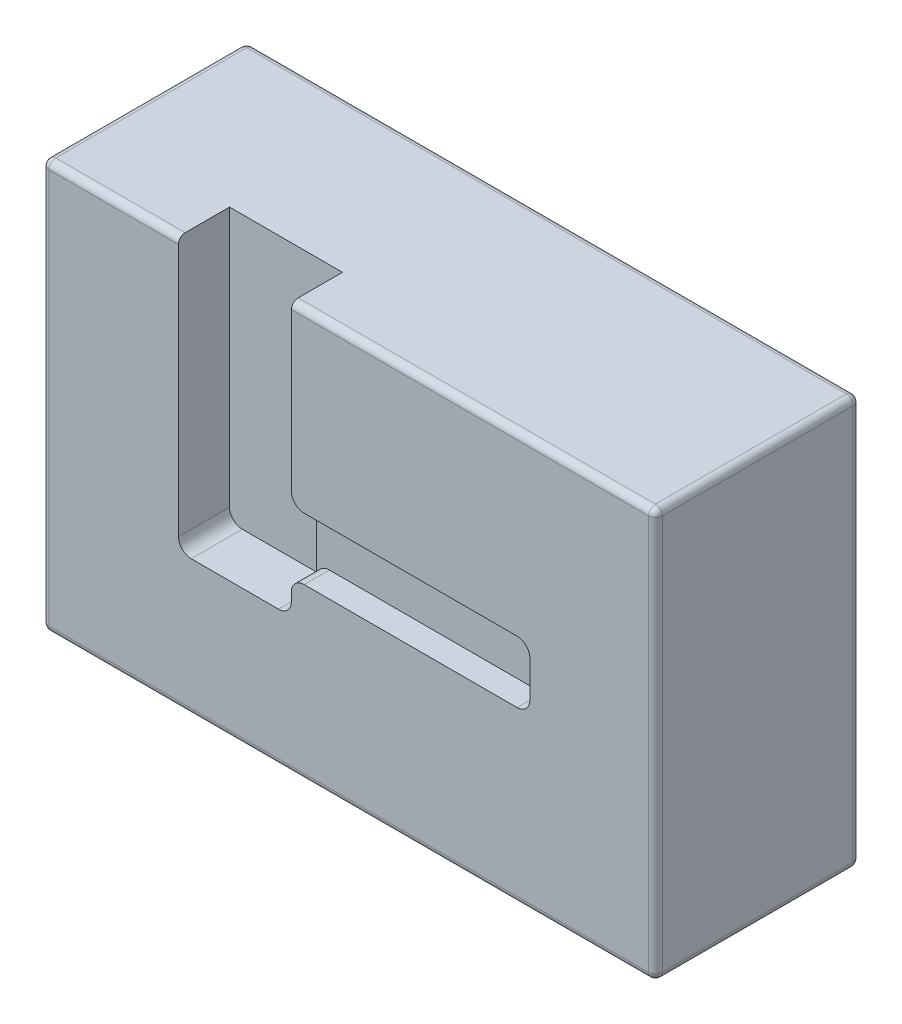
from build123d import *

# Parameters (mm, degrees)
SALIENTE_EXTRUIR1_DEPTH = 19.05
SALIENTE_EXTRUIR2_DEPTH = 38.1
CROQUIS1_5_W            = 88.9
CROQUIS1_5_H            = 19.05
SALIENTE_EXTRUIR3_DEPTH = 28.702
CROQUIS2_W              = 42.1
CROQUIS2_H              = 101.6
CORTAR_EXTRUIR1_DEPTH   = 19.05
REDONDEO1_R             = 4.7625
CROQUIS4_W              = 84.9
CROQUIS4_H              = 38.1
SALIENTE_EXTRUIR4_DEPTH = 15.05
CROQUIS5_W              = 228.6
CROQUIS5_H              = 152.4
SALIENTE_EXTRUIR5_DEPTH = 38.1
REDONDEO2_R             = 2.54
CROQUIS6_R              = 10
CORTAR_EXTRUIR2_DEPTH   = 71.2


with BuildPart() as part:
    # Croquis1 → Saliente-Extruir1 (new body)
    with BuildSketch(Plane.XY):
        Polygon((0, 152.4), (0, 0), (228.6, 0), (228.6, 137.35), (143.7, 137.35), (143.7, 152.4), align=None)
    extrude(amount=SALIENTE_EXTRUIR1_DEPTH)

    # Croquis1<4> → Saliente-Extruir2 (add)
    with BuildSketch(Plane.XY):
        Polygon((0, 152.4), (0, 0), (228.6, 0), (228.6, 137.35), (143.7, 137.35), (143.7, 152.4), (92.9, 152.4), (92.9, 86.55), (181.8, 86.55), (181.8, 63.5), (92.9, 63.5), (92.9, 50.8), (50.8, 50.8), (50.8, 152.4), align=None)
    extrude(amount=SALIENTE_EXTRUIR2_DEPTH)

    # Croquis1<5> → Saliente-Extruir3 (add)
    with BuildSketch(Plane.XY):
        with Locations((135.35, 75.025)):
            Rectangle(CROQUIS1_5_W, CROQUIS1_5_H)
        Polygon((92.9, 65.5), (92.9, 63.5), (181.8, 63.5), (181.8, 86.55), (92.9, 86.55), (92.9, 84.55), (179.8, 84.55), (179.8, 65.5), align=None)
    extrude(amount=SALIENTE_EXTRUIR3_DEPTH)

    # Croquis2 → Cortar-Extruir1 (cut)
    with BuildSketch(Plane.XY.offset(38.1)):
        with Locations((71.85, 101.6)):
            Rectangle(CROQUIS2_W, CROQUIS2_H)
    extrude(amount=-CORTAR_EXTRUIR1_DEPTH, mode=Mode.SUBTRACT)

    # Redondeo1
    redondeo1_edges = [part.edges().sort_by_distance(p)[0] for p in [
        (92.9, 86.55, 33.401),
        (181.8, 86.55, 33.401),
        (181.8, 63.5, 33.401),
        (92.9, 63.5, 33.401),
        (92.9, 50.8, 28.575),
        (50.8, 50.8, 28.575),
    ]]
    fillet(redondeo1_edges, radius=REDONDEO1_R)

    # Croquis4 → Saliente-Extruir4 (add)
    with BuildSketch(Plane(origin=(0, 137.35, 0), x_dir=(1, 0, 0), z_dir=(0, 1, 0))):
        with Locations((186.15, -19.05)):
            Rectangle(CROQUIS4_W, CROQUIS4_H)
    extrude(amount=SALIENTE_EXTRUIR4_DEPTH)

    # Croquis5 → Saliente-Extruir5 (add)
    with BuildSketch(Plane(origin=(0, 0, 0), x_dir=(-1, 0, 0), z_dir=(0, 0, -1))):
        with Locations((-114.3, 76.2)):
            Rectangle(CROQUIS5_W, CROQUIS5_H)
    extrude(amount=SALIENTE_EXTRUIR5_DEPTH)

    # Redondeo2
    redondeo2_edges = [part.edges().sort_by_distance(p)[0] for p in [
        (228.6, 0, 0),
        (0, 0, 0),
        (0, 152.4, 0),
        (228.6, 152.4, 0),
        (0, 76.2, -38.1),
        (114.3, 152.4, -38.1),
        (228.6, 76.2, -38.1),
        (114.3, 0, -38.1),
        (25.4, 152.4, 38.1),
        (0, 76.2, 38.1),
        (114.3, 0, 38.1),
        (228.6, 76.2, 38.1),
        (160.75, 152.4, 38.1),
    ]]
    fillet(redondeo2_edges, radius=REDONDEO2_R)

    # Croquis6 → Cortar-Extruir2 (cut)
    with BuildSketch(Plane(origin=(0, 0, -38.1), x_dir=(-1, 0, 0), z_dir=(0, 0, -1))):
        with Locations((-25.4, 127)):
            Circle(CROQUIS6_R)
        with Locations((-203.2, 127)):
            Circle(CROQUIS6_R)
        with Locations((-203.2, 25.4)):
            Circle(CROQUIS6_R)
        with Locations((-25.4, 25.4)):
            Circle(CROQUIS6_R)
        with Locations((-114.3, 25.4)):
            Circle(CROQUIS6_R)
    extrude(amount=-CORTAR_EXTRUIR2_DEPTH, mode=Mode.SUBTRACT)


solid = part.part
